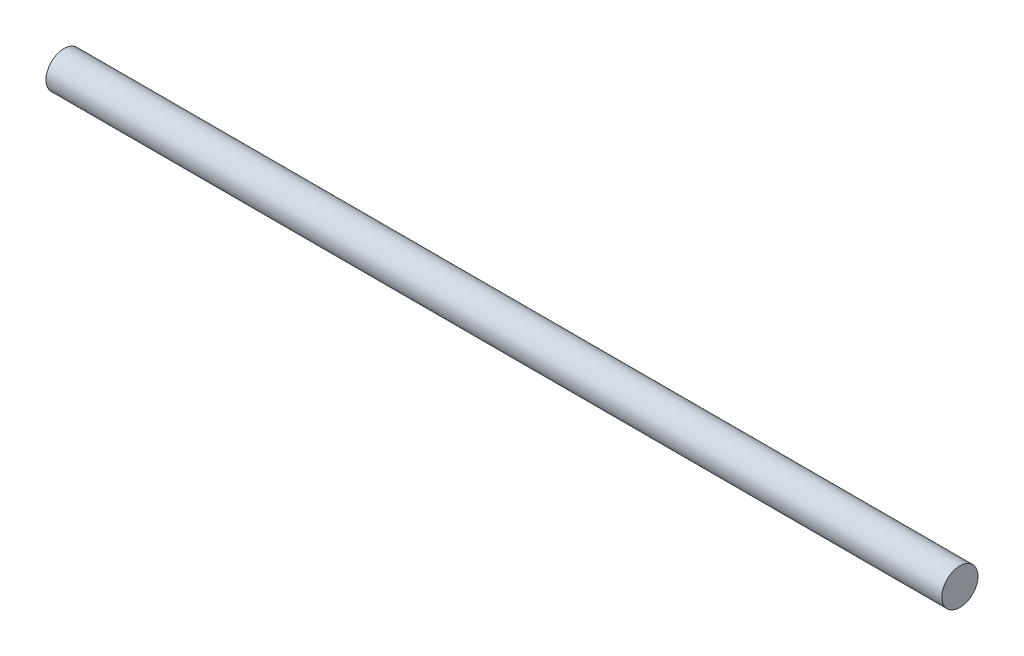
from build123d import *

# Parameters (mm, degrees)
SKETCH_1_R      = 2.625
EXTRUDE_1_DEPTH = 65


with BuildPart() as part:
    # 草图1 → 凸台-拉伸1 (new, symmetric)
    with BuildSketch(Plane(origin=(0, 0, 0), x_dir=(0, 0, -1), z_dir=(1, 0, 0))):
        Circle(SKETCH_1_R)
    extrude(amount=EXTRUDE_1_DEPTH, both=True)


solid = part.part
